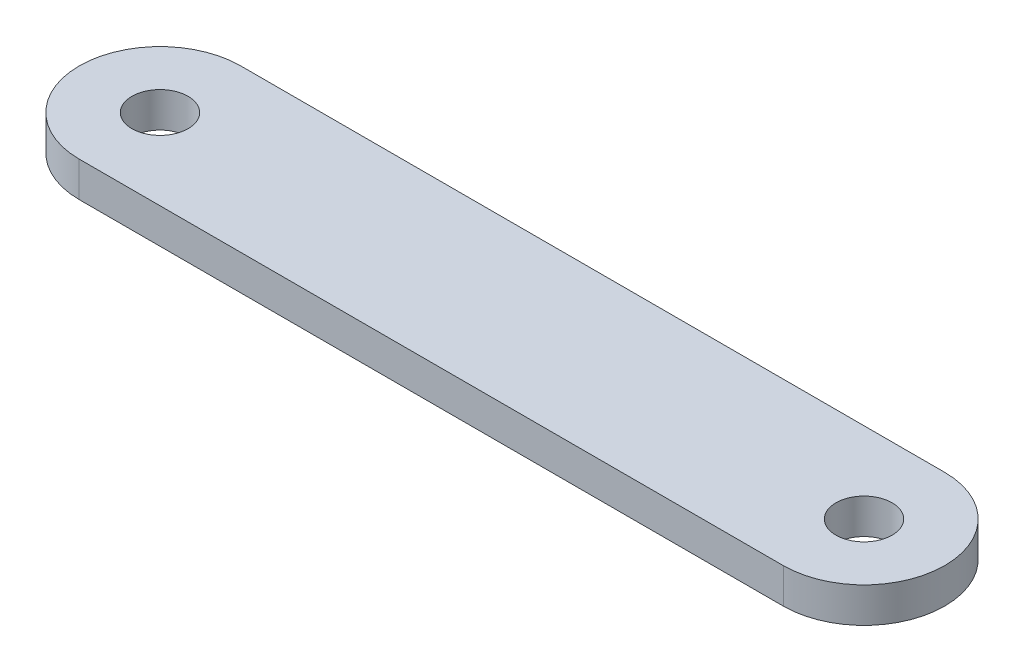
from build123d import *

# Parameters (mm, degrees)
BOSS_EXTRUDE1_DEPTH = 2


with BuildPart() as part:
    # Sketch1 → Boss-Extrude1 (new body)
    with BuildSketch(Plane(origin=(0, 0, 0), x_dir=(1, 0, 0), z_dir=(0, 1, 0))):
        with BuildLine():
            ThreePointArc((-9.493876204, 2.669468268), (-8.362505354, 2.200839118), (-7.893876204, 1.069468268))
            Line((-7.893876204, 1.069468268), (-4.893876204, 1.069468268))
            ThreePointArc((-4.893876204, 1.069468268), (-6.24118501, 4.322159461), (-9.493876204, 5.669468268))
            Line((-9.493876204, 5.669468268), (-9.493876204, 2.669468268))
        make_face()
        with BuildLine():
            ThreePointArc((-9.493876204, -0.530531732), (-11.093876204, 1.069468268), (-9.493876204, 2.669468268))
            Line((-9.493876204, 2.669468268), (-9.493876204, 5.669468268))
            ThreePointArc((-9.493876204, 5.669468268), (-14.093876204, 1.069468268), (-9.493876204, -3.530531732))
            Line((-9.493876204, -3.530531732), (-9.493876204, -0.530531732))
        make_face()
        with BuildLine():
            Line((-4.893876204, 1.069468268), (-7.893876204, 1.069468268))
            ThreePointArc((-7.893876204, 1.069468268), (-8.362505354, -0.061902582), (-9.493876204, -0.530531732))
            Line((-9.493876204, -0.530531732), (-9.493876204, -3.530531732))
            ThreePointArc((-9.493876204, -3.530531732), (-6.24118501, -2.183222925), (-4.893876204, 1.069468268))
        make_face()
        with BuildLine():
            Line((26.016123796, 1.069468268), (-4.893876204, 1.069468268))
            ThreePointArc((-4.893876204, 1.069468268), (-6.24118501, -2.183222925), (-9.493876204, -3.530531732))
            Line((-9.493876204, -3.530531732), (30.616123796, -3.530531732))
            ThreePointArc((30.616123796, -3.530531732), (27.363432603, -2.183222925), (26.016123796, 1.069468268))
        make_face()
        with BuildLine():
            ThreePointArc((-9.493876204, 5.669468268), (-6.24118501, 4.322159461), (-4.893876204, 1.069468268))
            Line((-4.893876204, 1.069468268), (26.016123796, 1.069468268))
            ThreePointArc((26.016123796, 1.069468268), (27.363432603, 4.322159461), (30.616123796, 5.669468268))
            Line((30.616123796, 5.669468268), (-9.493876204, 5.669468268))
        make_face()
        with BuildLine():
            Line((29.016123796, 1.069468268), (26.016123796, 1.069468268))
            ThreePointArc((26.016123796, 1.069468268), (27.363432603, -2.183222925), (30.616123796, -3.530531732))
            Line((30.616123796, -3.530531732), (30.616123796, -0.530531732))
            ThreePointArc((30.616123796, -0.530531732), (29.484752947, -0.061902582), (29.016123796, 1.069468268))
        make_face()
        with BuildLine():
            ThreePointArc((30.616123796, 5.669468268), (27.363432603, 4.322159461), (26.016123796, 1.069468268))
            Line((26.016123796, 1.069468268), (29.016123796, 1.069468268))
            ThreePointArc((29.016123796, 1.069468268), (29.484752947, 2.200839118), (30.616123796, 2.669468268))
            Line((30.616123796, 2.669468268), (30.616123796, 5.669468268))
        make_face()
        with BuildLine():
            ThreePointArc((35.216123796, 1.069468268), (33.86881499, 4.322159461), (30.616123796, 5.669468268))
            Line((30.616123796, 5.669468268), (30.616123796, 2.669468268))
            ThreePointArc((30.616123796, 2.669468268), (31.747494646, 2.200839118), (32.216123796, 1.069468268))
            ThreePointArc((32.216123796, 1.069468268), (31.747494646, -0.061902582), (30.616123796, -0.530531732))
            Line((30.616123796, -0.530531732), (30.616123796, -3.530531732))
            ThreePointArc((30.616123796, -3.530531732), (33.86881499, -2.183222925), (35.216123796, 1.069468268))
        make_face()
    extrude(amount=-BOSS_EXTRUDE1_DEPTH)


solid = part.part
